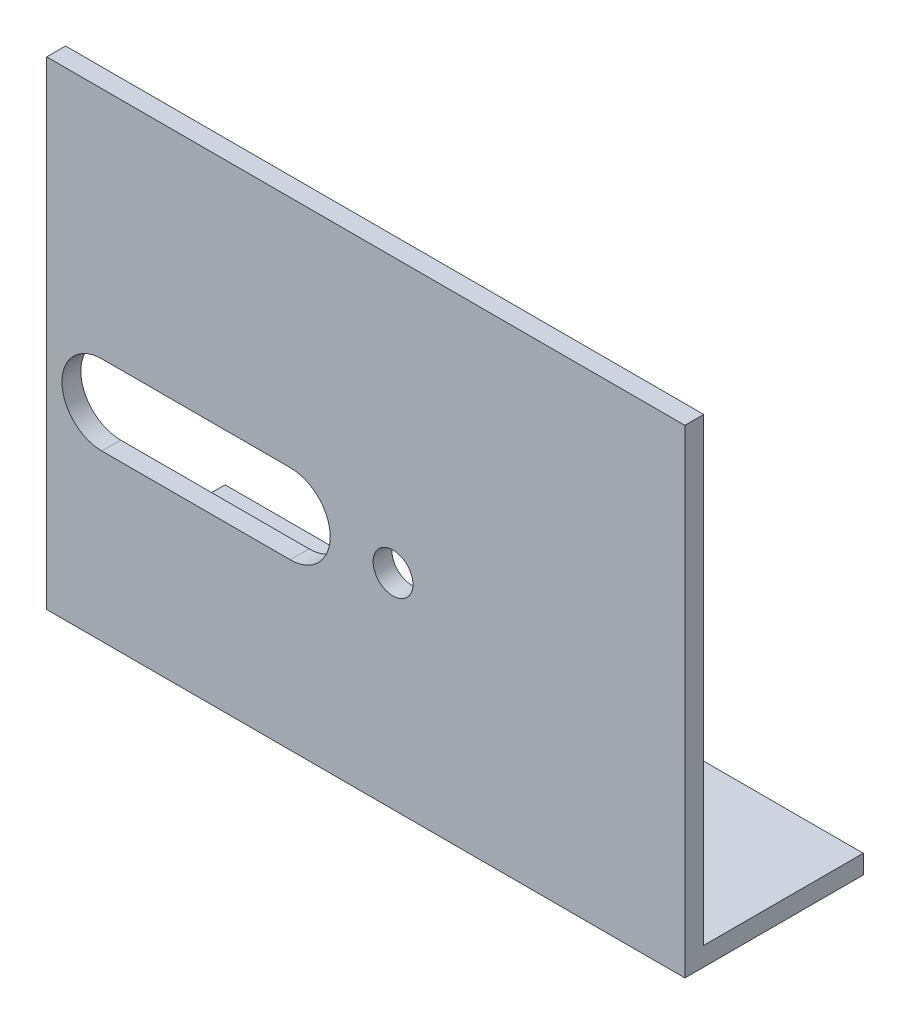
from build123d import *

# Parameters (mm, degrees)
CROQUIS1_W              = 101.6
CROQUIS1_H              = 76.2
SALIENTE_EXTRUIR1_DEPTH = 3
CROQUIS2_W              = 101.6
CROQUIS2_H              = 3
SALIENTE_EXTRUIR2_DEPTH = 25.4
CROQUIS3_R              = 3.175
CORTAR_EXTRUIR1_DEPTH   = 70.561555474


with BuildPart() as part:
    # Croquis1 → Saliente-Extruir1 (new body)
    with BuildSketch(Plane.XY):
        Rectangle(CROQUIS1_W, CROQUIS1_H)
    extrude(amount=SALIENTE_EXTRUIR1_DEPTH)

    # Croquis2 → Saliente-Extruir2 (add)
    with BuildSketch(Plane(origin=(0, 0, 0), x_dir=(-1, 0, 0), z_dir=(0, 0, -1))):
        with Locations((0, -36.6)):
            Rectangle(CROQUIS2_W, CROQUIS2_H)
    extrude(amount=SALIENTE_EXTRUIR2_DEPTH)

    # Croquis3 → Cortar-Extruir1 (cut, through all)
    with BuildSketch(Plane.XY.offset(3)):
        with Locations((4.33, -5.5)):
            Circle(CROQUIS3_R)
        with BuildLine():
            Line((-42.02, 0.85), (-12.02, 0.85))
            ThreePointArc((-12.02, 0.85), (-5.67, -5.5), (-12.02, -11.85))
            Line((-12.02, -11.85), (-42.02, -11.85))
            ThreePointArc((-42.02, -11.85), (-48.37, -5.5), (-42.02, 0.85))
        make_face()
    extrude(amount=-CORTAR_EXTRUIR1_DEPTH, mode=Mode.SUBTRACT)


solid = part.part
